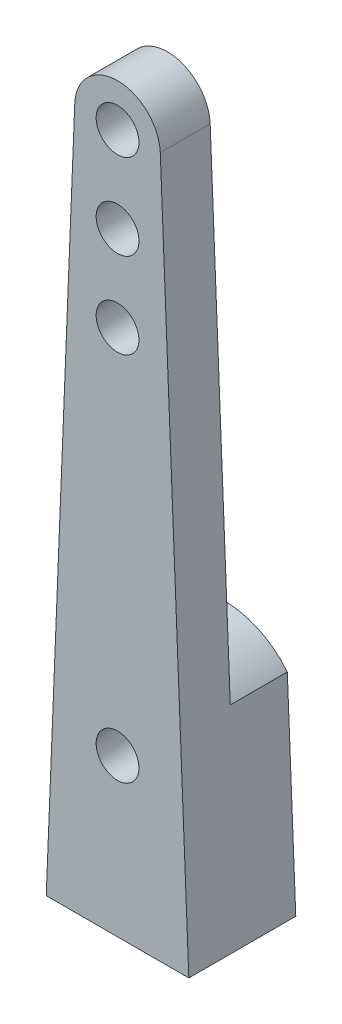
from build123d import *

# Parameters (mm, degrees)
SKETCH_1_R          = 1.5
SKETCH_1_R_2        = 2.75
EXTRUDE_1_DEPTH     = 3.5
EXTRUDE_2_DEPTH     = 4
EXTRUDE_START       = -5
SKETCH_4_R          = 2.75
EXTRUDE_3_DEPTH     = 5
SKETCH_5_R          = 2.75
CUT_EXTRUDE_2_DEPTH = 4
SKETCH_6_R          = 1.5
CUT_EXTRUDE_3_DEPTH = 4


with BuildPart() as part:
    # 草图1 → 凸台-拉伸1 (new body)
    with BuildSketch(Plane.XY):
        with BuildLine():
            Line((-5, 0), (5, 0))
            Line((5, 0), (2.997510367, 49.122194935))
            ThreePointArc((2.997510367, 49.122194935), (0, 52), (-2.997510367, 49.122194935))
            Line((-2.997510367, 49.122194935), (-5, 0))
        make_face()
        with Locations((0, 49)):
            Circle(SKETCH_1_R, mode=Mode.SUBTRACT)
        with Locations((0, 43)):
            Circle(SKETCH_1_R, mode=Mode.SUBTRACT)
        with Locations((0, 37)):
            Circle(SKETCH_1_R, mode=Mode.SUBTRACT)
        with Locations((0, 11)):
            Circle(SKETCH_1_R_2, mode=Mode.SUBTRACT)
    extrude(amount=EXTRUDE_1_DEPTH)

    # 草图2 → 凸台-拉伸2 (add)
    with BuildSketch(Plane(origin=(0, 0, 0), x_dir=(-1, 0, 0), z_dir=(0, 0, -1))):
        with BuildLine():
            Line((5, 0), (4.407228658, 14.541013804))
            ThreePointArc((4.407228658, 14.541013804), (0, 16.653533692), (-4.407228658, 14.541013804))
            Line((-4.407228658, 14.541013804), (-5, 0))
            Line((-5, 0), (5, 0))
        make_face()
    extrude(amount=EXTRUDE_2_DEPTH)

    # 草图4 → 凸台-拉伸3 (add)
    with BuildSketch(Plane.XY.offset(3.5).offset(EXTRUDE_START)):
        with Locations((0, 11)):
            Circle(SKETCH_4_R)
    extrude(amount=EXTRUDE_3_DEPTH)

    # 草图5 → 切除-拉伸2 (cut)
    with BuildSketch(Plane(origin=(0, 0, -4), x_dir=(-1, 0, 0), z_dir=(0, 0, -1))):
        with Locations((0, 11)):
            Circle(SKETCH_5_R)
    extrude(amount=-CUT_EXTRUDE_2_DEPTH, mode=Mode.SUBTRACT)

    # 草图6 → 切除-拉伸3 (cut)
    with BuildSketch(Plane(origin=(0, 0, 0), x_dir=(-1, 0, 0), z_dir=(0, 0, -1))):
        with Locations((0, 11)):
            Circle(SKETCH_6_R)
    extrude(amount=-CUT_EXTRUDE_3_DEPTH, mode=Mode.SUBTRACT)


solid = part.part
